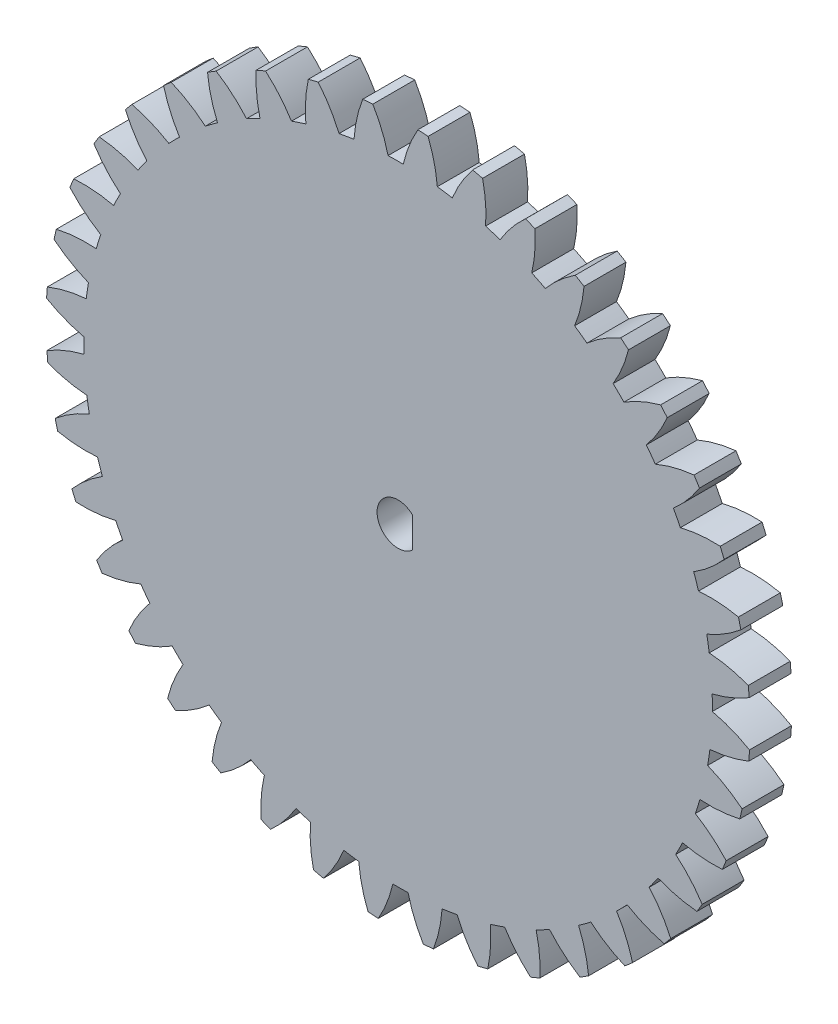
from build123d import *

# Parameters (mm, degrees)
BOSS_EXTRUDE1_DEPTH = 6.35
CUT_EXTRUDE2_REACH  = 77.582


with BuildPart() as part:
    # Sketch1 → Boss-Extrude1 (new body)
    with BuildSketch(Plane.XY):
        with BuildLine():
            ThreePointArc((-53.25531002, 3.004588931), (-50.519604915, 1.682221979), (-47.617299719, 0.782576864))
            ThreePointArc((-47.617299719, 0.782576864), (-47.622325401, -0.365762868), (-47.599661726, -1.513889932))
            ThreePointArc((-47.599661726, -1.513889932), (-50.487805909, -2.458008545), (-53.202876617, -3.822240134))
            ThreePointArc((-53.202876617, -3.822240134), (-53.141860267, -4.59328721), (-53.069670044, -5.363368478))
            ThreePointArc((-53.069670044, -5.363368478), (-50.160782241, -6.241496333), (-47.153473737, -6.676044764))
            ThreePointArc((-47.153473737, -6.676044764), (-46.978797632, -7.811032718), (-46.776806341, -8.941479053))
            ThreePointArc((-46.776806341, -8.941479053), (-49.481699987, -10.325779289), (-51.94993083, -12.097945558))
            ThreePointArc((-51.94993083, -12.097945558), (-51.769047356, -12.849954704), (-51.577278663, -13.599261955))
            ThreePointArc((-51.577278663, -13.599261955), (-48.566834635, -14.011528292), (-45.528572737, -13.970280013))
            ThreePointArc((-45.528572737, -13.970280013), (-45.178495952, -15.06396902), (-44.802150741, -16.148899285))
            ThreePointArc((-44.802150741, -16.148899285), (-47.257190391, -17.939295078), (-49.417805334, -20.075759411))
            ThreePointArc((-49.417805334, -20.075759411), (-49.121508687, -20.790213667), (-48.814883506, -21.50029647))
            ThreePointArc((-48.814883506, -21.50029647), (-45.777010376, -21.436549923), (-42.782607176, -20.920520604))
            ThreePointArc((-42.782607176, -20.920520604), (-42.265749762, -21.945980409), (-41.7243175, -22.958680021))
            ThreePointArc((-41.7243175, -22.958680021), (-43.869051929, -25.111085885), (-45.668849463, -27.55924144))
            ThreePointArc((-45.668849463, -27.55924144), (-45.264435449, -28.218548571), (-44.85050391, -28.87192233))
            ThreePointArc((-44.85050391, -28.87192233), (-41.860004196, -28.333732551), (-38.983191839, -27.355628546))
            ThreePointArc((-38.983191839, -27.355628546), (-38.312280542, -28.287608927), (-37.619093087, -29.203141859))
            ThreePointArc((-37.619093087, -29.203141859), (-39.400711816, -31.664558419), (-40.795374951, -34.36412348))
            ThreePointArc((-40.795374951, -34.36412348), (-40.292801587, -34.952049157), (-39.781756057, -35.532625642))
            ThreePointArc((-39.781756057, -35.532625642), (-36.912265787, -34.533244649), (-34.223880941, -33.117150126))
            ThreePointArc((-34.223880941, -33.117150126), (-33.415435823, -33.932702631), (-32.587561751, -34.728525425))
            ThreePointArc((-32.587561751, -34.728525425), (-33.962195415, -37.438344436), (-34.917382916, -40.322846753))
            ThreePointArc((-34.917382916, -40.322846753), (-34.329025225, -40.824914293), (-33.733449343, -41.318397784))
            ThreePointArc((-33.733449343, -41.318397784), (-31.05562489, -39.882433654), (-28.621864512, -38.06321756))
            ThreePointArc((-28.621864512, -38.06321756), (-27.695792175, -38.742260581), (-26.753616493, -39.398777438))
            ThreePointArc((-26.753616493, -39.398777438), (-27.687417049, -42.290274162), (-28.17960903, -45.288687715))
            ThreePointArc((-28.17960903, -45.288687715), (-27.519954331, -45.69253455), (-26.85451315, -46.086773845))
            ThreePointArc((-26.85451315, -46.086773845), (-24.434291441, -44.249584781), (-22.315082788, -42.072042252))
            ThreePointArc((-22.315082788, -42.072042252), (-21.294186206, -42.597855497), (-20.260908408, -43.098900794))
            ThreePointArc((-20.260908408, -43.098900794), (-20.730882585, -46.100876985), (-20.747959646, -49.13937088))
            ThreePointArc((-20.747959646, -49.13937088), (-20.033250828, -49.435052961), (-19.314329719, -49.720340581))
            ThreePointArc((-19.314329719, -49.720340581), (-17.211304643, -47.527164275), (-15.458829666, -45.044913636))
            ThreePointArc((-15.458829666, -45.044913636), (-14.368246702, -45.404549836), (-13.269309515, -45.737786174))
            ThreePointArc((-13.269309515, -45.737786174), (-13.263884991, -48.776323216), (-12.805426638, -51.780079651))
            ThreePointArc((-12.805426638, -51.780079651), (-12.053262203, -51.960316303), (-11.298563389, -52.12962752))
            ThreePointArc((-11.298563389, -52.12962752), (-9.564518404, -49.63446725), (-8.221928853, -46.90862975))
            ThreePointArc((-8.221928853, -46.90862975), (-7.088513278, -47.09323347), (-5.950976183, -47.250455464))
            ThreePointArc((-5.950976183, -47.250455464), (-5.470286528, -50.25073449), (-4.547581527, -53.145791012))
            ThreePointArc((-4.547581527, -53.145791012), (-3.77648226, -53.20614421), (-3.004588931, -53.25531002))
            ThreePointArc((-3.004588931, -53.25531002), (-1.682221979, -50.519604915), (-0.782576864, -47.617299719))
            ThreePointArc((-0.782576864, -47.617299719), (0.365762868, -47.622325401), (1.513889932, -47.599661726))
            ThreePointArc((1.513889932, -47.599661726), (2.458008545, -50.487805909), (3.822240134, -53.202876617))
            ThreePointArc((3.822240134, -53.202876617), (4.59328721, -53.141860267), (5.363368478, -53.069670044))
            ThreePointArc((5.363368478, -53.069670044), (6.241496333, -50.160782241), (6.676044764, -47.153473737))
            ThreePointArc((6.676044764, -47.153473737), (7.811032718, -46.978797632), (8.941479053, -46.776806341))
            ThreePointArc((8.941479053, -46.776806341), (10.325779289, -49.481699987), (12.097945558, -51.94993083))
            ThreePointArc((12.097945558, -51.94993083), (12.849954704, -51.769047356), (13.599261955, -51.577278663))
            ThreePointArc((13.599261955, -51.577278663), (14.011528292, -48.566834635), (13.970280013, -45.528572737))
            ThreePointArc((13.970280013, -45.528572737), (15.06396902, -45.178495952), (16.148899285, -44.802150741))
            ThreePointArc((16.148899285, -44.802150741), (17.939295078, -47.257190391), (20.075759411, -49.417805334))
            ThreePointArc((20.075759411, -49.417805334), (20.790213667, -49.121508687), (21.50029647, -48.814883506))
            ThreePointArc((21.50029647, -48.814883506), (21.436549923, -45.777010376), (20.920520604, -42.782607176))
            ThreePointArc((20.920520604, -42.782607176), (21.945980409, -42.265749762), (22.958680021, -41.7243175))
            ThreePointArc((22.958680021, -41.7243175), (25.111085885, -43.869051929), (27.55924144, -45.668849463))
            ThreePointArc((27.55924144, -45.668849463), (28.218548571, -45.264435449), (28.87192233, -44.85050391))
            ThreePointArc((28.87192233, -44.85050391), (28.333732551, -41.860004196), (27.355628546, -38.983191839))
            ThreePointArc((27.355628546, -38.983191839), (28.287608927, -38.312280542), (29.203141859, -37.619093087))
            ThreePointArc((29.203141859, -37.619093087), (31.664558419, -39.400711816), (34.36412348, -40.795374951))
            ThreePointArc((34.36412348, -40.795374951), (34.952049157, -40.292801587), (35.532625642, -39.781756057))
            ThreePointArc((35.532625642, -39.781756057), (34.533244649, -36.912265787), (33.117150126, -34.223880941))
            ThreePointArc((33.117150126, -34.223880941), (33.932702631, -33.415435823), (34.728525425, -32.587561751))
            ThreePointArc((34.728525425, -32.587561751), (37.438344436, -33.962195415), (40.322846753, -34.917382916))
            ThreePointArc((40.322846753, -34.917382916), (40.824914293, -34.329025225), (41.318397784, -33.733449343))
            ThreePointArc((41.318397784, -33.733449343), (39.882433654, -31.05562489), (38.06321756, -28.621864512))
            ThreePointArc((38.06321756, -28.621864512), (38.742260581, -27.695792175), (39.398777438, -26.753616493))
            ThreePointArc((39.398777438, -26.753616493), (42.290274162, -27.687417049), (45.288687715, -28.17960903))
            ThreePointArc((45.288687715, -28.17960903), (45.69253455, -27.519954331), (46.086773845, -26.85451315))
            ThreePointArc((46.086773845, -26.85451315), (44.249584781, -24.434291441), (42.072042252, -22.315082788))
            ThreePointArc((42.072042252, -22.315082788), (42.597855497, -21.294186206), (43.098900794, -20.260908408))
            ThreePointArc((43.098900794, -20.260908408), (46.100876985, -20.730882585), (49.13937088, -20.747959646))
            ThreePointArc((49.13937088, -20.747959646), (49.435052961, -20.033250828), (49.720340581, -19.314329719))
            ThreePointArc((49.720340581, -19.314329719), (47.527164275, -17.211304643), (45.044913636, -15.458829666))
            ThreePointArc((45.044913636, -15.458829666), (45.404549836, -14.368246702), (45.737786174, -13.269309515))
            ThreePointArc((45.737786174, -13.269309515), (48.776323216, -13.263884991), (51.780079651, -12.805426638))
            ThreePointArc((51.780079651, -12.805426638), (51.960316303, -12.053262203), (52.12962752, -11.298563389))
            ThreePointArc((52.12962752, -11.298563389), (49.63446725, -9.564518404), (46.90862975, -8.221928853))
            ThreePointArc((46.90862975, -8.221928853), (47.09323347, -7.088513278), (47.250455464, -5.950976183))
            ThreePointArc((47.250455464, -5.950976183), (50.25073449, -5.470286528), (53.145791012, -4.547581527))
            ThreePointArc((53.145791012, -4.547581527), (53.20614421, -3.77648226), (53.25531002, -3.004588931))
            ThreePointArc((53.25531002, -3.004588931), (50.519604915, -1.682221979), (47.617299719, -0.782576864))
            ThreePointArc((47.617299719, -0.782576864), (47.622325401, 0.365762868), (47.599661726, 1.513889932))
            ThreePointArc((47.599661726, 1.513889932), (50.487805909, 2.458008545), (53.202876617, 3.822240134))
            ThreePointArc((53.202876617, 3.822240134), (53.141860267, 4.59328721), (53.069670044, 5.363368478))
            ThreePointArc((53.069670044, 5.363368478), (50.160782241, 6.241496333), (47.153473737, 6.676044764))
            ThreePointArc((47.153473737, 6.676044764), (46.978797632, 7.811032718), (46.776806341, 8.941479053))
            ThreePointArc((46.776806341, 8.941479053), (49.481699987, 10.325779289), (51.94993083, 12.097945558))
            ThreePointArc((51.94993083, 12.097945558), (51.769047356, 12.849954704), (51.577278663, 13.599261955))
            ThreePointArc((51.577278663, 13.599261955), (48.566834635, 14.011528292), (45.528572737, 13.970280013))
            ThreePointArc((45.528572737, 13.970280013), (45.178495952, 15.06396902), (44.802150741, 16.148899285))
            ThreePointArc((44.802150741, 16.148899285), (47.257190391, 17.939295078), (49.417805334, 20.075759411))
            ThreePointArc((49.417805334, 20.075759411), (49.121508687, 20.790213667), (48.814883506, 21.50029647))
            ThreePointArc((48.814883506, 21.50029647), (45.777010376, 21.436549923), (42.782607176, 20.920520604))
            ThreePointArc((42.782607176, 20.920520604), (42.265749762, 21.945980409), (41.7243175, 22.958680021))
            ThreePointArc((41.7243175, 22.958680021), (43.869051929, 25.111085885), (45.668849463, 27.55924144))
            ThreePointArc((45.668849463, 27.55924144), (45.264435449, 28.218548571), (44.85050391, 28.87192233))
            ThreePointArc((44.85050391, 28.87192233), (41.860004196, 28.333732551), (38.983191839, 27.355628546))
            ThreePointArc((38.983191839, 27.355628546), (38.312280542, 28.287608927), (37.619093087, 29.203141859))
            ThreePointArc((37.619093087, 29.203141859), (39.400711816, 31.664558419), (40.795374951, 34.36412348))
            ThreePointArc((40.795374951, 34.36412348), (40.292801587, 34.952049157), (39.781756057, 35.532625642))
            ThreePointArc((39.781756057, 35.532625642), (36.912265787, 34.533244649), (34.223880941, 33.117150126))
            ThreePointArc((34.223880941, 33.117150126), (33.415435823, 33.932702631), (32.587561751, 34.728525425))
            ThreePointArc((32.587561751, 34.728525425), (33.962195415, 37.438344436), (34.917382916, 40.322846753))
            ThreePointArc((34.917382916, 40.322846753), (34.329025225, 40.824914293), (33.733449343, 41.318397784))
            ThreePointArc((33.733449343, 41.318397784), (31.05562489, 39.882433654), (28.621864512, 38.06321756))
            ThreePointArc((28.621864512, 38.06321756), (27.695792175, 38.742260581), (26.753616493, 39.398777438))
            ThreePointArc((26.753616493, 39.398777438), (27.687417049, 42.290274162), (28.17960903, 45.288687715))
            ThreePointArc((28.17960903, 45.288687715), (27.519954331, 45.69253455), (26.85451315, 46.086773845))
            ThreePointArc((26.85451315, 46.086773845), (24.434291441, 44.249584781), (22.315082788, 42.072042252))
            ThreePointArc((22.315082788, 42.072042252), (21.294186206, 42.597855497), (20.260908408, 43.098900794))
            ThreePointArc((20.260908408, 43.098900794), (20.730882585, 46.100876985), (20.747959646, 49.13937088))
            ThreePointArc((20.747959646, 49.13937088), (20.033250828, 49.435052961), (19.314329719, 49.720340581))
            ThreePointArc((19.314329719, 49.720340581), (17.211304643, 47.527164275), (15.458829666, 45.044913636))
            ThreePointArc((15.458829666, 45.044913636), (14.368246702, 45.404549836), (13.269309515, 45.737786174))
            ThreePointArc((13.269309515, 45.737786174), (13.263884991, 48.776323216), (12.805426638, 51.780079651))
            ThreePointArc((12.805426638, 51.780079651), (12.053262203, 51.960316303), (11.298563389, 52.12962752))
            ThreePointArc((11.298563389, 52.12962752), (9.564518404, 49.63446725), (8.221928853, 46.90862975))
            ThreePointArc((8.221928853, 46.90862975), (7.088513278, 47.09323347), (5.950976183, 47.250455464))
            ThreePointArc((5.950976183, 47.250455464), (5.470286528, 50.25073449), (4.547581527, 53.145791012))
            ThreePointArc((4.547581527, 53.145791012), (3.77648226, 53.20614421), (3.004588931, 53.25531002))
            ThreePointArc((3.004588931, 53.25531002), (1.682221979, 50.519604915), (0.782576864, 47.617299719))
            ThreePointArc((0.782576864, 47.617299719), (-0.365762868, 47.622325401), (-1.513889932, 47.599661726))
            ThreePointArc((-1.513889932, 47.599661726), (-2.458008545, 50.487805909), (-3.822240134, 53.202876617))
            ThreePointArc((-3.822240134, 53.202876617), (-4.59328721, 53.141860267), (-5.363368478, 53.069670044))
            ThreePointArc((-5.363368478, 53.069670044), (-6.241496333, 50.160782241), (-6.676044764, 47.153473737))
            ThreePointArc((-6.676044764, 47.153473737), (-7.811032718, 46.978797632), (-8.941479053, 46.776806341))
            ThreePointArc((-8.941479053, 46.776806341), (-10.325779289, 49.481699987), (-12.097945558, 51.94993083))
            ThreePointArc((-12.097945558, 51.94993083), (-12.849954704, 51.769047356), (-13.599261955, 51.577278663))
            ThreePointArc((-13.599261955, 51.577278663), (-14.011528292, 48.566834635), (-13.970280013, 45.528572737))
            ThreePointArc((-13.970280013, 45.528572737), (-15.06396902, 45.178495952), (-16.148899285, 44.802150741))
            ThreePointArc((-16.148899285, 44.802150741), (-17.939295078, 47.257190391), (-20.075759411, 49.417805334))
            ThreePointArc((-20.075759411, 49.417805334), (-20.790213667, 49.121508687), (-21.50029647, 48.814883506))
            ThreePointArc((-21.50029647, 48.814883506), (-21.436549923, 45.777010376), (-20.920520604, 42.782607176))
            ThreePointArc((-20.920520604, 42.782607176), (-21.945980409, 42.265749762), (-22.958680021, 41.7243175))
            ThreePointArc((-22.958680021, 41.7243175), (-25.111085885, 43.869051929), (-27.55924144, 45.668849463))
            ThreePointArc((-27.55924144, 45.668849463), (-28.218548571, 45.264435449), (-28.87192233, 44.85050391))
            ThreePointArc((-28.87192233, 44.85050391), (-28.333732551, 41.860004196), (-27.355628546, 38.983191839))
            ThreePointArc((-27.355628546, 38.983191839), (-28.287608927, 38.312280542), (-29.203141859, 37.619093087))
            ThreePointArc((-29.203141859, 37.619093087), (-31.664558419, 39.400711816), (-34.36412348, 40.795374951))
            ThreePointArc((-34.36412348, 40.795374951), (-34.952049157, 40.292801587), (-35.532625642, 39.781756057))
            ThreePointArc((-35.532625642, 39.781756057), (-34.533244649, 36.912265787), (-33.117150126, 34.223880941))
            ThreePointArc((-33.117150126, 34.223880941), (-33.932702631, 33.415435823), (-34.728525425, 32.587561751))
            ThreePointArc((-34.728525425, 32.587561751), (-37.438344436, 33.962195415), (-40.322846753, 34.917382916))
            ThreePointArc((-40.322846753, 34.917382916), (-40.824914293, 34.329025225), (-41.318397784, 33.733449343))
            ThreePointArc((-41.318397784, 33.733449343), (-39.882433654, 31.05562489), (-38.06321756, 28.621864512))
            ThreePointArc((-38.06321756, 28.621864512), (-38.742260581, 27.695792175), (-39.398777438, 26.753616493))
            ThreePointArc((-39.398777438, 26.753616493), (-42.290274162, 27.687417049), (-45.288687715, 28.17960903))
            ThreePointArc((-45.288687715, 28.17960903), (-45.69253455, 27.519954331), (-46.086773845, 26.85451315))
            ThreePointArc((-46.086773845, 26.85451315), (-44.249584781, 24.434291441), (-42.072042252, 22.315082788))
            ThreePointArc((-42.072042252, 22.315082788), (-42.597855497, 21.294186206), (-43.098900794, 20.260908408))
            ThreePointArc((-43.098900794, 20.260908408), (-46.100876985, 20.730882585), (-49.13937088, 20.747959646))
            ThreePointArc((-49.13937088, 20.747959646), (-49.435052961, 20.033250828), (-49.720340581, 19.314329719))
            ThreePointArc((-49.720340581, 19.314329719), (-47.527164275, 17.211304643), (-45.044913636, 15.458829666))
            ThreePointArc((-45.044913636, 15.458829666), (-45.404549836, 14.368246702), (-45.737786174, 13.269309515))
            ThreePointArc((-45.737786174, 13.269309515), (-48.776323216, 13.263884991), (-51.780079651, 12.805426638))
            ThreePointArc((-51.780079651, 12.805426638), (-51.960316303, 12.053262203), (-52.12962752, 11.298563389))
            ThreePointArc((-52.12962752, 11.298563389), (-49.63446725, 9.564518404), (-46.90862975, 8.221928853))
            ThreePointArc((-46.90862975, 8.221928853), (-47.09323347, 7.088513278), (-47.250455464, 5.950976183))
            ThreePointArc((-47.250455464, 5.950976183), (-50.25073449, 5.470286528), (-53.145791012, 4.547581527))
            ThreePointArc((-53.145791012, 4.547581527), (-53.20614421, 3.77648226), (-53.25531002, 3.004588931))
        make_face()
    extrude(amount=BOSS_EXTRUDE1_DEPTH)

    # Sketch3 → Cut-Extrude2 (cut, up to next)
    with BuildSketch(Plane.XY.offset(6.35), mode=Mode.PRIVATE) as cut_extrude2_sk1:
        with BuildLine():
            Line((2.1828125, 2.305635398), (2.1828125, -2.305635398))
            ThreePointArc((2.1828125, -2.305635398), (-3.175, 0), (2.1828125, 2.305635398))
        make_face()
    cut_extrude2_tool1 = extrude(cut_extrude2_sk1.sketch, amount=-CUT_EXTRUDE2_REACH, mode=Mode.PRIVATE) & part.part
    add(cut_extrude2_tool1.solids().sort_by_distance((-0.286616, 0, 6.35))[0], mode=Mode.SUBTRACT)


solid = part.part
